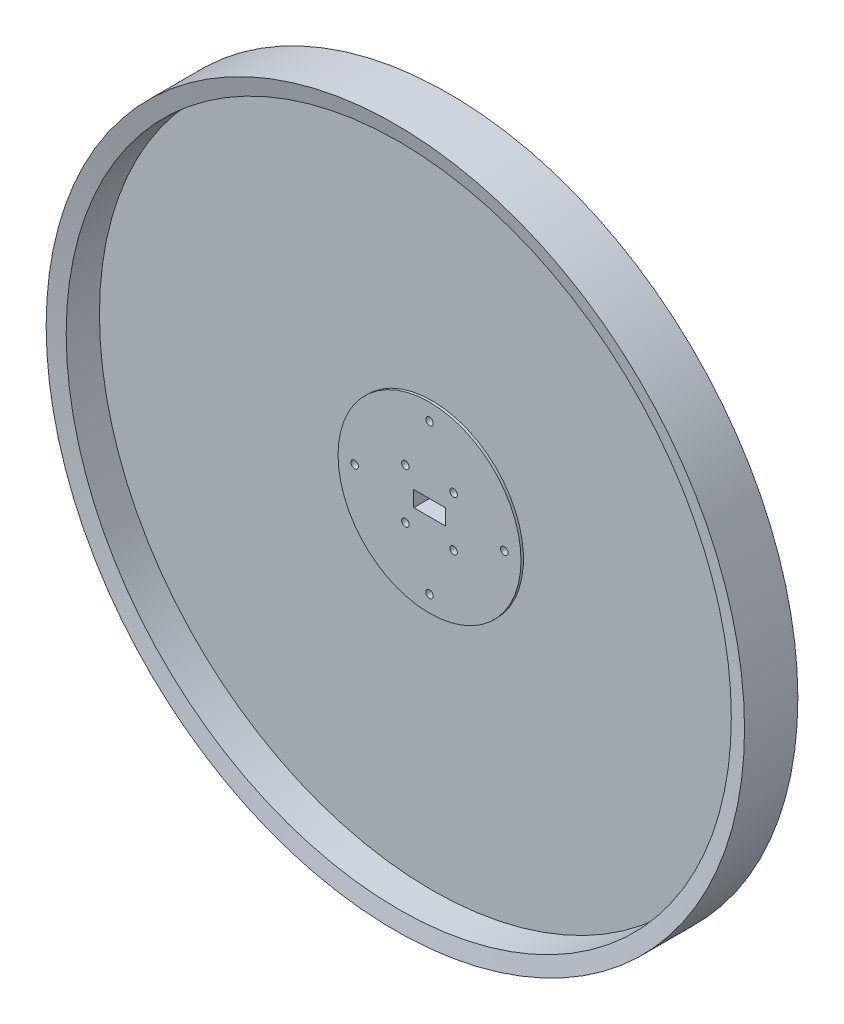
from build123d import *

# Parameters (mm, degrees)
CUT_EXTRUDE_1_DEPTH         = 298.8022876
CUT_EXTRUDE_1_DEPTH_BACK    = 298.8022876
SKETCH_2_W                  = 19
SKETCH_2_H                  = 9.5
SKETCH_3_R                  = 55
EXTRUDE_1_DEPTH             = 1.5125
SKETCH_4_W                  = 19
SKETCH_4_H                  = 9.5
CUT_EXTRUDE_2_DEPTH         = 2
HOLE_WIZARD_M41_D           = 4.5
PATTERN_CIRCULAR_1_COUNT    = 4
HOLE_WIZARD_M42_D           = 4.5
HOLE_WIZARD_M42_CSINK_D     = 4.55
HOLE_WIZARD_M42_CSINK_ANGLE = 90


with BuildPart() as part:
    # Эскиз1 → Повернуть1 (revolve)
    with BuildSketch(Plane(origin=(0, 0, 0), x_dir=(1, 0, 0), z_dir=(0, 1, 0)), mode=Mode.PRIVATE) as revolve_1_sk:
        Polygon((0, 0), (200, 0), (200, -20), (210, -22.05), (210, 10), (0, 10), align=None)
    revolve(revolve_1_sk.sketch.rotate(Axis((0, 0, -10), (0, 0, 1)), 180), axis=Axis((0, 0, -10), (0, 0, 1)))

    # Эскиз2 → Вырез-Вытянуть1 (cut, two sides: drawn at the far end of the back side and taken through both)
    with BuildSketch(Plane.XY.offset(-CUT_EXTRUDE_1_DEPTH_BACK)):
        Rectangle(SKETCH_2_W, SKETCH_2_H)
    extrude(amount=CUT_EXTRUDE_1_DEPTH + CUT_EXTRUDE_1_DEPTH_BACK, mode=Mode.SUBTRACT)

    # Эскиз3 → Бобышка-Вытянуть1 (add)
    with BuildSketch(Plane.XY):
        with Locations(Location((0, 0, 0), (0, 0, 180))):
            Circle(SKETCH_3_R)
    extrude(amount=EXTRUDE_1_DEPTH)

    # Эскиз4 → Вырез-Вытянуть2 (cut)
    with BuildSketch(Plane.XY.offset(1.5125)):
        Rectangle(SKETCH_4_W, SKETCH_4_H)
    extrude(amount=-CUT_EXTRUDE_2_DEPTH, mode=Mode.SUBTRACT)

    # Отверстие с зазором M41 (through all)
    with Locations(Plane(origin=(0, 45, 1.5125), x_dir=(1, 0, 0), z_dir=(0, 0, 1))):
        with Locations((0, 0)):
            hole_wizard_m41 = Hole(HOLE_WIZARD_M41_D / 2)

    # Круговой массив1: Отверстие с зазором M41 ×4 about axis
    pattern_circular_1_axis = Axis((0, 0, 0), (0, 0, 1))
    for i in range(1, PATTERN_CIRCULAR_1_COUNT):
        add(hole_wizard_m41.rotate(pattern_circular_1_axis, i * 360 / PATTERN_CIRCULAR_1_COUNT), mode=Mode.SUBTRACT)

    # Отверстие с зазором M42 (through all)
    with Locations(Plane(origin=(-14.5, 15, -10), x_dir=(-1, 0, 0), z_dir=(0, 0, -1))):
        with Locations((0, 0), (-29, 0), (-29, -30), (0, -30)):
            CounterSinkHole(HOLE_WIZARD_M42_D / 2, HOLE_WIZARD_M42_CSINK_D / 2, counter_sink_angle=HOLE_WIZARD_M42_CSINK_ANGLE)


solid = part.part
